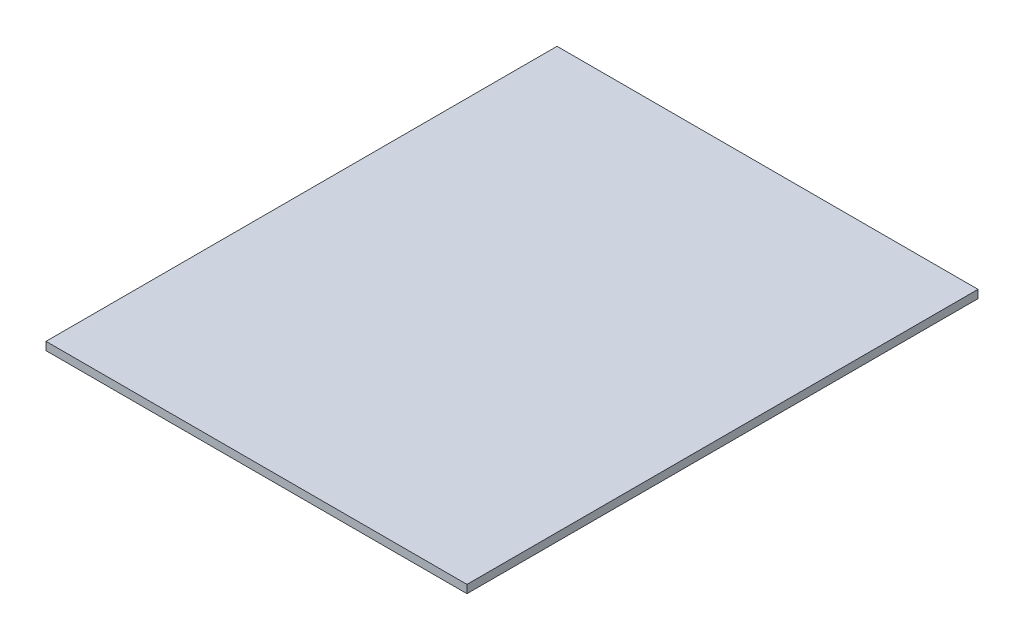
from build123d import *

# Parameters (mm, degrees)
SKETCH1_W            = 624
SKETCH1_H            = 12
DET2_RAF_UST_1_DEPTH = 757.5


with BuildPart() as part:
    # Sketch1 → DET2_raf_ust_1 (new body)
    with BuildSketch(Plane.XY):
        with Locations((1026, 1614)):
            Rectangle(SKETCH1_W, SKETCH1_H)
    extrude(amount=-DET2_RAF_UST_1_DEPTH)


solid = part.part
